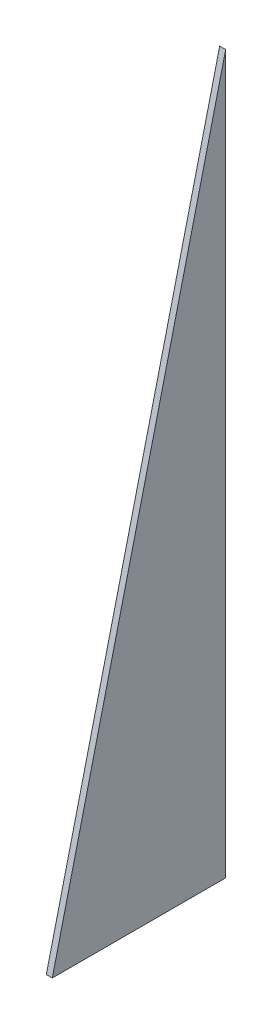
from build123d import *

# Parameters (mm, degrees)
SALIENTE_EXTRUIR1_DEPTH = 5


with BuildPart() as part:
    # Croquis1 → Saliente-Extruir1 (new body)
    with BuildSketch(Plane(origin=(0, 0, 0), x_dir=(0, 0, -1), z_dir=(1, 0, 0))):
        Polygon((72.5, -300), (-72.5, -300), (72.5, 300), align=None)
    extrude(amount=SALIENTE_EXTRUIR1_DEPTH)


solid = part.part
